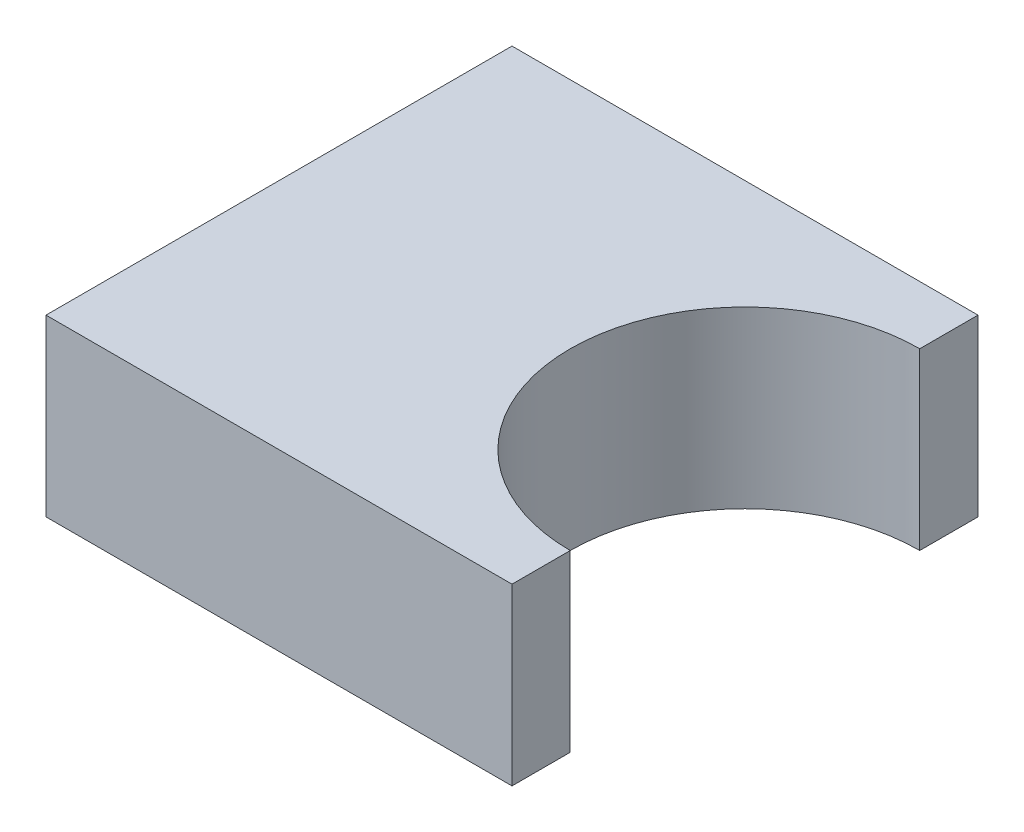
from build123d import *

# Parameters (mm, degrees)
SKETCH1_W           = 800
SKETCH1_H           = 300
BOSS_EXTRUDE1_DEPTH = 800
SKETCH2_R           = 300
CUT_EXTRUDE1_DEPTH  = 500


with BuildPart() as part:
    # Sketch1 → Boss-Extrude1 (new body)
    with BuildSketch(Plane.XY):
        with Locations((400, 150)):
            Rectangle(SKETCH1_W, SKETCH1_H)
    extrude(amount=BOSS_EXTRUDE1_DEPTH)

    # Sketch2 → Cut-Extrude1 (cut)
    with BuildSketch(Plane(origin=(0, 300, 0), x_dir=(1, 0, 0), z_dir=(0, 1, 0))):
        with Locations((800, -400)):
            Circle(SKETCH2_R)
    extrude(amount=-CUT_EXTRUDE1_DEPTH, mode=Mode.SUBTRACT)


solid = part.part
